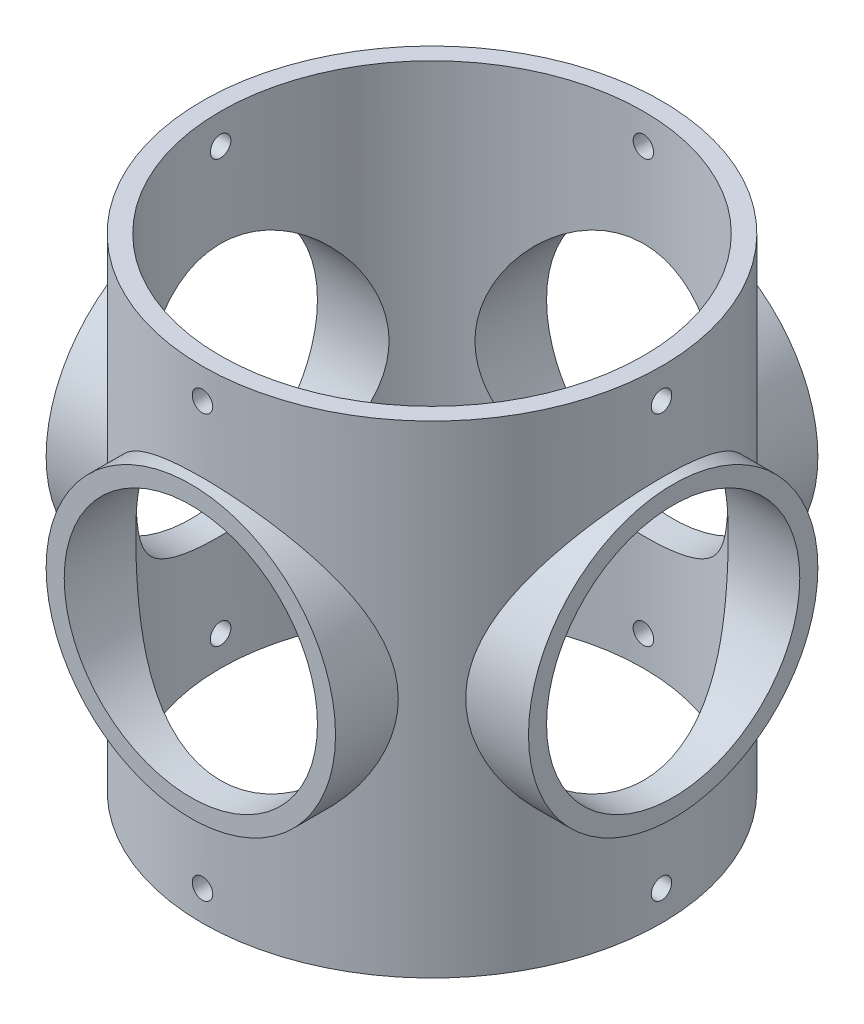
from build123d import *

# Parameters (mm, degrees)
SKETCH1_R               = 38.1
BOSS_EXTRUDE1_DEPTH     = 40
SKETCH3_R               = 24
BOSS_EXTRUDE2_DEPTH     = 40
SKETCH2_R               = 21
CUT_EXTRUDE1_DEPTH      = 69.202712729
SKETCH6_R               = 1.7
CUT_EXTRUDE5_DEPTH      = 69.202712729
CIRPATTERN1_COUNT       = 2
CIRPATTERN1_ANGLE       = 90
CUT_EXTRUDE2_DEPTH      = 98.979589875
CUT_EXTRUDE2_DEPTH_BACK = 98.979589875
SKETCH4_R               = 35.1


with BuildPart() as part:
    # Sketch1 → Boss-Extrude1 (new, symmetric)
    with BuildSketch(Plane(origin=(0, 0, 0), x_dir=(1, 0, 0), z_dir=(0, 1, 0))):
        Circle(SKETCH1_R)
    extrude(amount=BOSS_EXTRUDE1_DEPTH, both=True)

    # Sketch3 → Boss-Extrude2 (add, symmetric)
    with BuildSketch(Plane.XY):
        Circle(SKETCH3_R)
    boss_extrude2 = extrude(amount=BOSS_EXTRUDE2_DEPTH, both=True)

    # Sketch2 → Cut-Extrude1 (cut, symmetric)
    with BuildSketch(Plane.XY):
        Circle(SKETCH2_R)
    cut_extrude1 = extrude(amount=CUT_EXTRUDE1_DEPTH, both=True, mode=Mode.SUBTRACT)

    # Sketch6 → Cut-Extrude5 (cut, symmetric)
    with BuildSketch(Plane.XY):
        with Locations((0, 35)):
            Circle(SKETCH6_R)
        with Locations((0, -35)):
            Circle(SKETCH6_R)
    cut_extrude5 = extrude(amount=CUT_EXTRUDE5_DEPTH, both=True, mode=Mode.SUBTRACT)

    # CirPattern1: Boss-Extrude2, Cut-Extrude1, Cut-Extrude5 ×2 about axis
    cirpattern1_axis = Axis((0, 40, 0), (0, -1, 0))
    add([boss_extrude2.rotate(cirpattern1_axis, i * CIRPATTERN1_ANGLE / (CIRPATTERN1_COUNT - 1)) for i in range(1, CIRPATTERN1_COUNT)])
    add([cut_extrude1.rotate(cirpattern1_axis, i * CIRPATTERN1_ANGLE / (CIRPATTERN1_COUNT - 1)) for i in range(1, CIRPATTERN1_COUNT)], mode=Mode.SUBTRACT)
    add([cut_extrude5.rotate(cirpattern1_axis, i * CIRPATTERN1_ANGLE / (CIRPATTERN1_COUNT - 1)) for i in range(1, CIRPATTERN1_COUNT)], mode=Mode.SUBTRACT)

    # Sketch4 → Cut-Extrude2 (cut, two sides: drawn at the far end of the back side and taken through both)
    with BuildSketch(Plane(origin=(0, 40, 0), x_dir=(1, 0, 0), z_dir=(0, 1, 0)).offset(-CUT_EXTRUDE2_DEPTH_BACK)):
        Circle(SKETCH4_R)
    extrude(amount=CUT_EXTRUDE2_DEPTH + CUT_EXTRUDE2_DEPTH_BACK, mode=Mode.SUBTRACT)


solid = part.part
